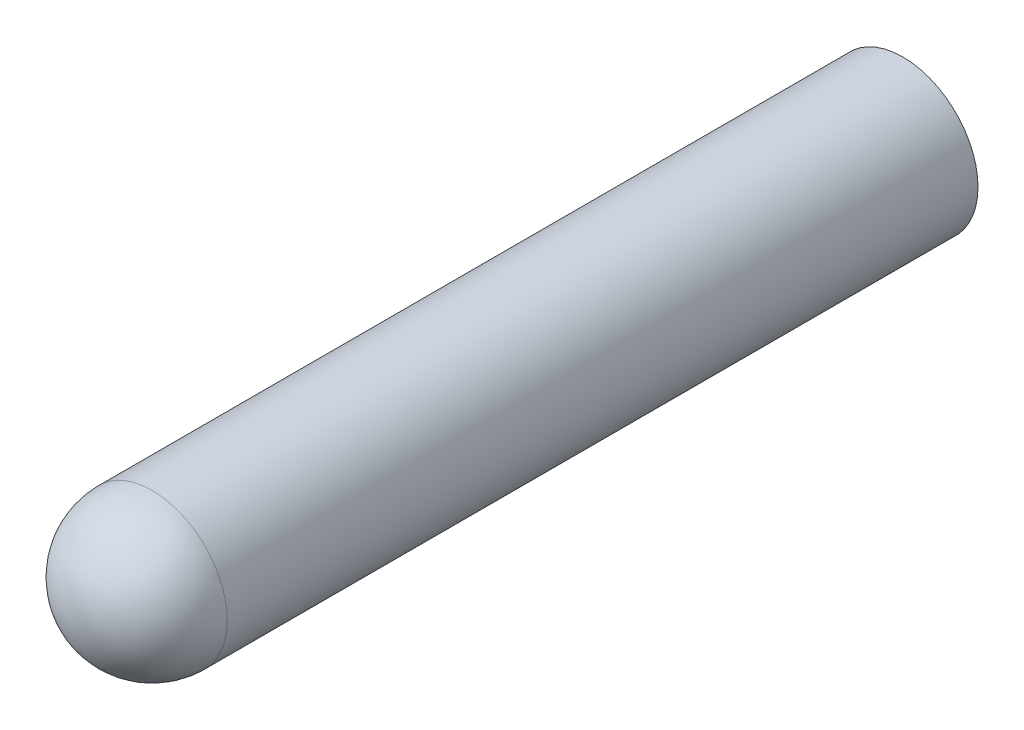
from build123d import *

# Parameters (mm, degrees)
SKETCH_1_R      = 1
EXTRUDE_1_DEPTH = 5.5
FILLET_1_R      = 1


with BuildPart() as part:
    # 草图1 → 凸台-拉伸1 (new, symmetric)
    with BuildSketch(Plane.XY):
        Circle(SKETCH_1_R)
    extrude(amount=EXTRUDE_1_DEPTH, both=True)

    # 圆角1
    fillet_1_edges = [part.edges().sort_by_distance(p)[0] for p in [
        (-1, 0, 5.5),
    ]]
    fillet(fillet_1_edges, radius=FILLET_1_R)


solid = part.part
